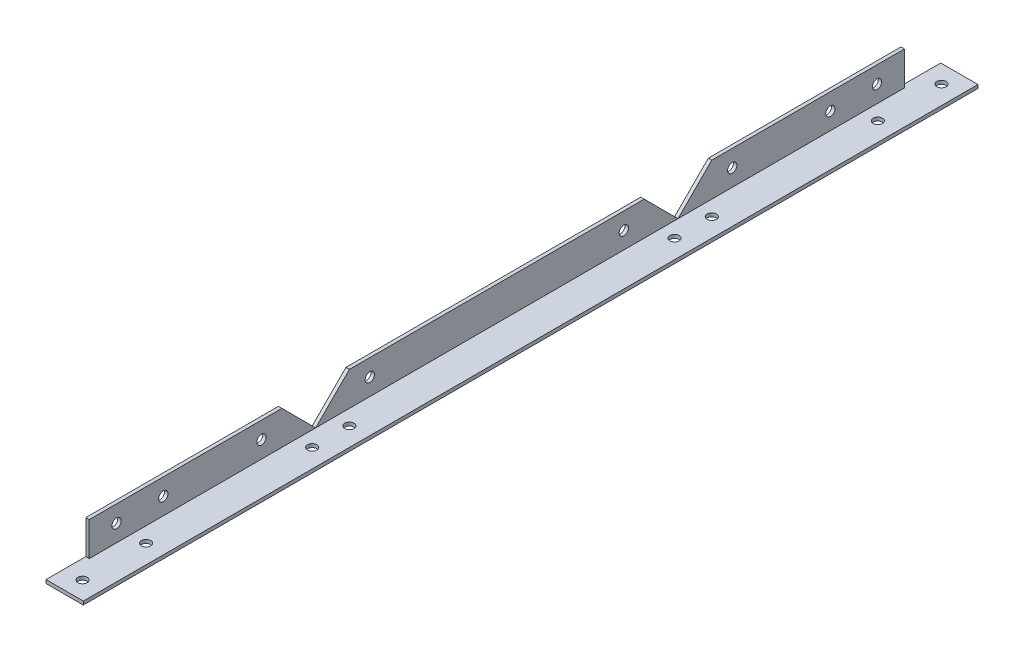
from build123d import *

# Parameters (mm, degrees)
BOSS_EXTRUDE1_DEPTH = 208.28
SKETCH2_R           = 2.38125
CUT_EXTRUDE1_DEPTH  = 1.778
SKETCH3_W           = 19.05
SKETCH3_H           = 1.778
BOSS_EXTRUDE2_DEPTH = 20.32
SKETCH4_R           = 2.38125
CUT_EXTRUDE2_DEPTH  = 1.778


with BuildPart() as part:
    # Sketch1 → Boss-Extrude1 (new body)
    with BuildSketch(Plane.XY):
        Polygon((0, 0), (0, 17.272), (-1.778, 17.272), (-1.778, -1.778), (17.272, -1.778), (17.272, 0), align=None)
    boss_extrude1 = extrude(amount=BOSS_EXTRUDE1_DEPTH)

    # Sketch2 → Cut-Extrude1 (cut)
    with BuildSketch(Plane(origin=(0, 0, 0), x_dir=(0, 0, -1), z_dir=(1, 0, 0))):
        with Locations(Location((-194.31, 8.636, 0), (0, 0, 90))):
            Circle(SKETCH2_R)
        with Locations(Location((-170.434, 8.636, 0), (0, 0, 90))):
            Circle(SKETCH2_R)
        with Locations(Location((-120.269, 8.636, 0), (0, 0, 90))):
            Circle(SKETCH2_R)
        with Locations(Location((-64.897, 8.636, 0), (0, 0, 90))):
            Circle(SKETCH2_R)
        Polygon((-92.583, 0), (-109.855, 17.272), (-75.311, 17.272), align=None)
    cut_extrude1 = extrude(amount=-CUT_EXTRUDE1_DEPTH, mode=Mode.SUBTRACT)

    # Sketch3 → Boss-Extrude2 (add)
    with BuildSketch(Plane.XY.offset(208.28)):
        with Locations((7.747, -0.889)):
            Rectangle(SKETCH3_W, SKETCH3_H)
    boss_extrude2 = extrude(amount=BOSS_EXTRUDE2_DEPTH)

    # Sketch4 → Cut-Extrude2 (cut)
    with BuildSketch(Plane(origin=(0, 0, 0), x_dir=(1, 0, 0), z_dir=(0, 1, 0))):
        with Locations(Location((7.747, -219.456, 0), (0, 0, 180))):
            Circle(SKETCH4_R)
        with Locations(Location((7.747, -83.058, 0), (0, 0, 180))):
            Circle(SKETCH4_R)
        with Locations(Location((7.747, -102.108, 0), (0, 0, 180))):
            Circle(SKETCH4_R)
        with Locations(Location((7.747, -186.944, 0), (0, 0, 180))):
            Circle(SKETCH4_R)
    cut_extrude2 = extrude(amount=-CUT_EXTRUDE2_DEPTH, mode=Mode.SUBTRACT)

    # Mirror3: Boss-Extrude1, Cut-Extrude1, Boss-Extrude2, Cut-Extrude2 across plane
    add(boss_extrude1.mirror(Plane(origin=(0, 0, 0), x_dir=(1, 0, 0), z_dir=(0, 0, -1))))
    add(cut_extrude1.mirror(Plane(origin=(0, 0, 0), x_dir=(1, 0, 0), z_dir=(0, 0, -1))), mode=Mode.SUBTRACT)
    add(boss_extrude2.mirror(Plane(origin=(0, 0, 0), x_dir=(1, 0, 0), z_dir=(0, 0, -1))))
    add(cut_extrude2.mirror(Plane(origin=(0, 0, 0), x_dir=(1, 0, 0), z_dir=(0, 0, -1))), mode=Mode.SUBTRACT)


solid = part.part
